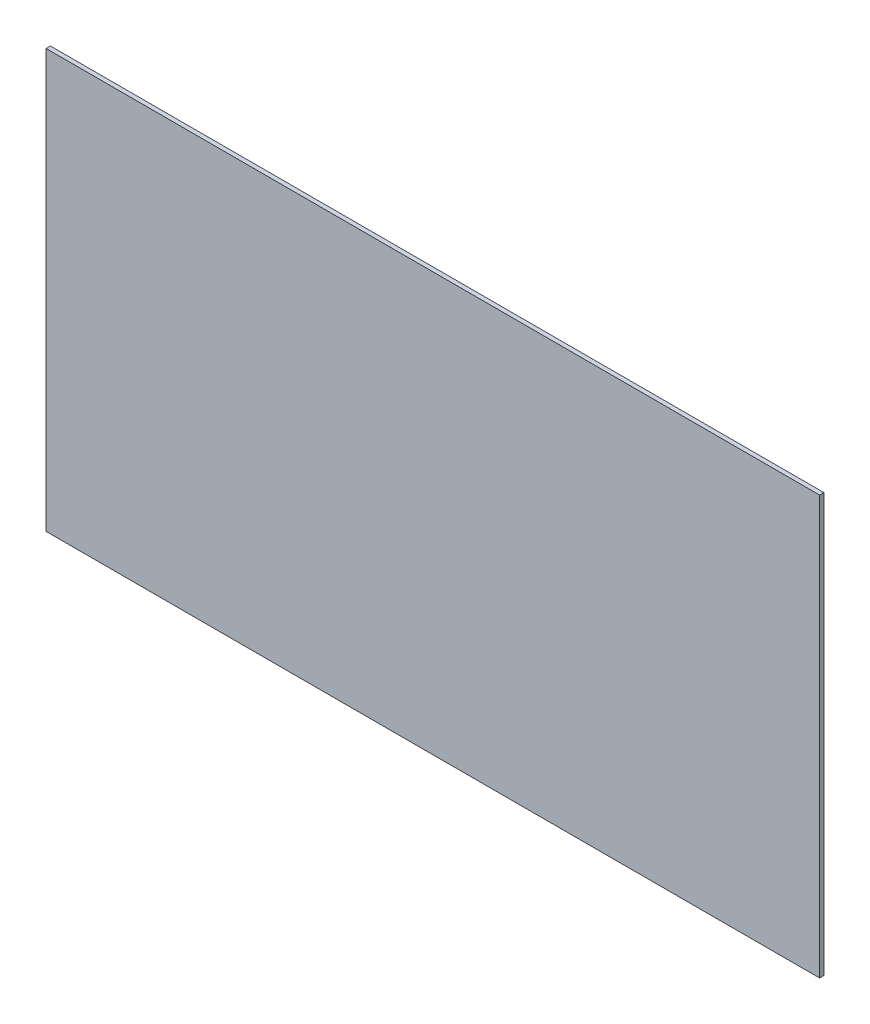
from build123d import *

# Parameters (mm, degrees)
SKETCH1_W           = 540
SKETCH1_H           = 292
BOSS_EXTRUDE1_DEPTH = 3


with BuildPart() as part:
    # Sketch1 → Boss-Extrude1 (new body)
    with BuildSketch(Plane.XY):
        with Locations((-281.229112559, -146)):
            Rectangle(SKETCH1_W, SKETCH1_H)
    extrude(amount=BOSS_EXTRUDE1_DEPTH)


solid = part.part
